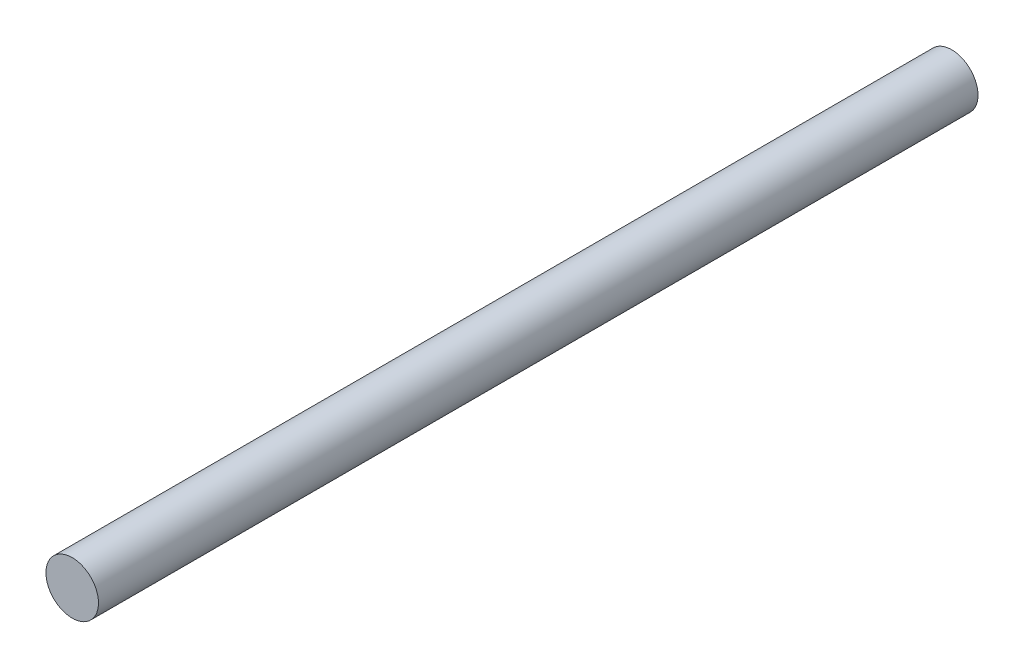
from build123d import *

# Parameters (mm, degrees)
SKETCH1_R           = 4
BOSS_EXTRUDE1_DEPTH = 134


with BuildPart() as part:
    # Sketch1 → Boss-Extrude1 (new body)
    with BuildSketch(Plane.XY):
        Circle(SKETCH1_R)
    extrude(amount=BOSS_EXTRUDE1_DEPTH)


solid = part.part
